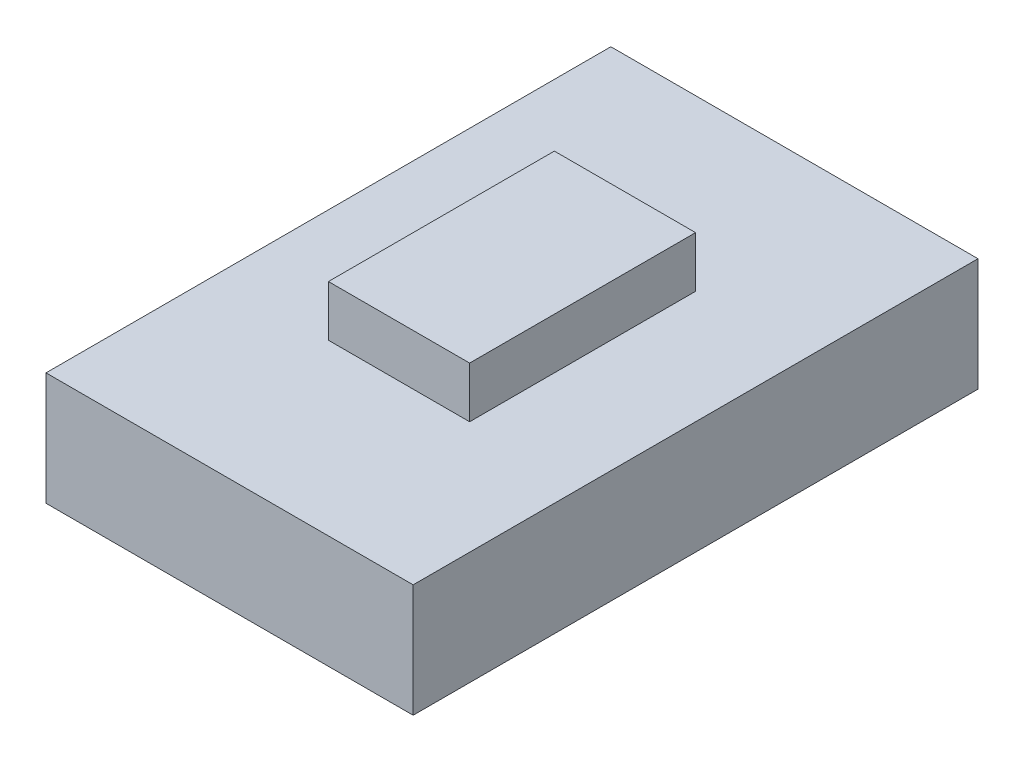
from build123d import *

# Parameters (mm, degrees)
SKETCH1_W           = 1.25
SKETCH1_H           = 2
BOSS_EXTRUDE1_DEPTH = 0.45
BOSS_EXTRUDE3_DEPTH = 1


with BuildPart() as part:
    # Sketch1 → Boss-Extrude1 (new body)
    with BuildSketch(Plane(origin=(0, 0, 0), x_dir=(1, 0, 0), z_dir=(0, 1, 0))):
        with Locations((0.625, 1)):
            Rectangle(SKETCH1_W, SKETCH1_H)
    extrude(amount=BOSS_EXTRUDE1_DEPTH)

    # Sketch2 → Boss-Extrude3 (add)
    with BuildSketch(Plane.XZ):
        Polygon((0.56061007, -3.5), (0.625, -3.5), (2.25, -3.5), (2.25, 1.5), (-1, 1.5), (-1, -3.5), align=None)
    extrude(amount=BOSS_EXTRUDE3_DEPTH)


solid = part.part
